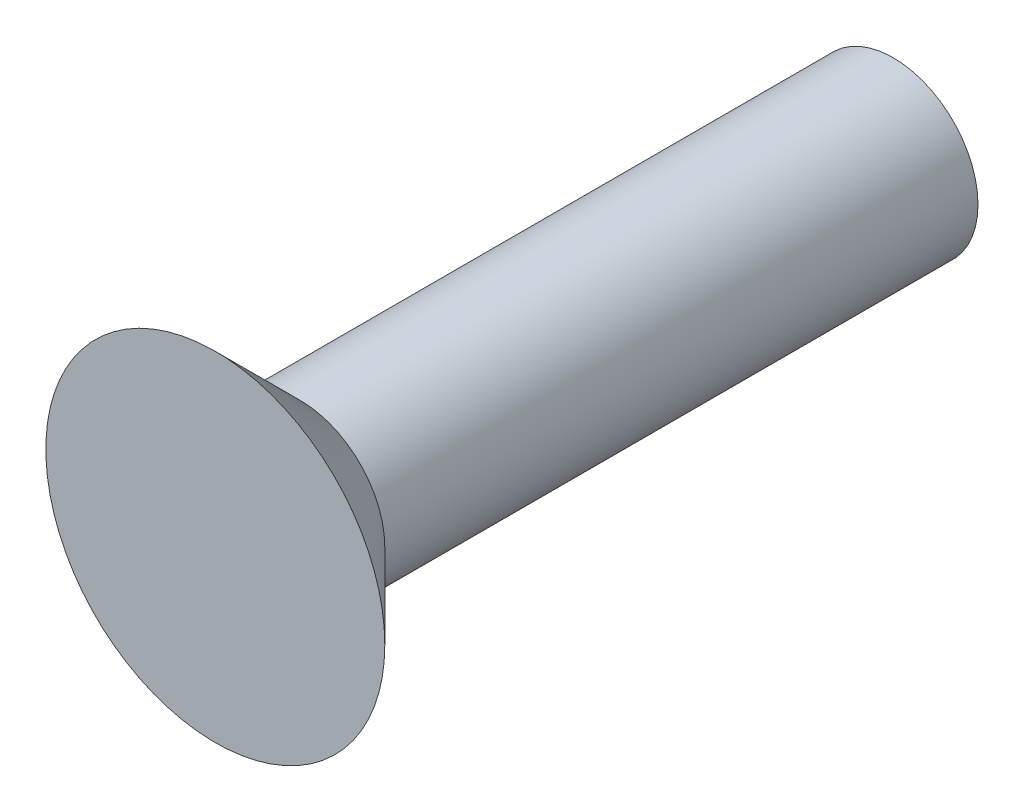
from build123d import *

# Parameters (mm, degrees)
SKETCH1_R                       = 2.5
HEAD_D5_90DEG_DEPTH             = 1.25
HEAD_D5_90DEG_DRAFT             = -45
M2P5X0P45_THREAD_ENVELOPE_START = -10
SKETCH2_R                       = 1.25
M2P5X0P45_THREAD_ENVELOPE_DEPTH = 8.75


with BuildPart() as part:
    # Sketch1 → Head_D5_90deg (with draft: the straight prism first)
    with BuildSketch(Plane.XY):
        Circle(SKETCH1_R)
    extrude(amount=-HEAD_D5_90DEG_DEPTH)
    # Head_D5_90deg: the draft: its side faces are tilted about the plane it starts from
    head_d5_90deg_sides = [part.faces().sort_by_distance(p)[0] for p in [
        (-2.5, 0, -0.625),
    ]]
    draft(head_d5_90deg_sides, Plane.XY, HEAD_D5_90DEG_DRAFT)

    # Sketch2 → M2p5x0p45_Thread_Envelope (add)
    with BuildSketch(Plane.XY.offset(M2P5X0P45_THREAD_ENVELOPE_START)):
        Circle(SKETCH2_R)
    extrude(amount=M2P5X0P45_THREAD_ENVELOPE_DEPTH)


solid = part.part
